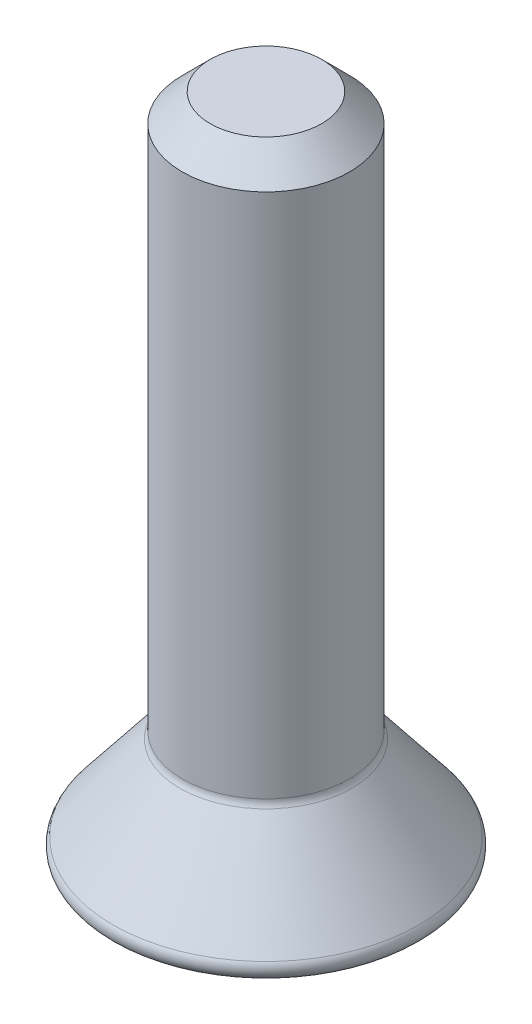
from build123d import *

# Parameters (mm, degrees)
SKETCH_2_R          = 1.5
EXTRUDE_1_DEPTH     = 10
CUT_EXTRUDE_1_DEPTH = 1
CHAMFER_1_SIZE      = 0.5
FILLET_1_R          = 0.2


with BuildPart() as part:
    # 草图1 → 旋转2 (revolve)
    with BuildSketch(Plane.XY, mode=Mode.PRIVATE) as revolve_2_sk:
        Polygon((0, 1.9), (1.5, 1.9), (3, 0), (0, 0), align=None)
    revolve(revolve_2_sk.sketch.rotate(Axis((0, 3.310292653, 0), (0, -1, 0)), 90), axis=Axis((0, 3.310292653, 0), (0, -1, 0)))

    # 草图2 → 凸台-拉伸1 (add)
    with BuildSketch(Plane(origin=(0, 1.9, 0), x_dir=(1, 0, 0), z_dir=(0, 1, 0))):
        with Locations(Location((0, 0, 0), (0, 0, 270))):
            Circle(SKETCH_2_R)
    extrude(amount=EXTRUDE_1_DEPTH)

    # 草图3 → 切除-拉伸1 (cut)
    with BuildSketch(Plane.XZ):
        Polygon((0, 1.154700538), (-1, 0.577350269), (-1, -0.577350269), (0, -1.154700538), (1, -0.577350269), (1, 0.577350269), align=None)
    extrude(amount=-CUT_EXTRUDE_1_DEPTH, mode=Mode.SUBTRACT)

    # 倒角1
    chamfer_1_edges = [part.edges().sort_by_distance(p)[0] for p in [
        (0, 11.9, -1.5),
    ]]
    chamfer(chamfer_1_edges, length=CHAMFER_1_SIZE)

    # 圆角1
    fillet_1_edges = [part.edges().sort_by_distance(p)[0] for p in [
        (0, 0, -3),
        (0, 1.9, -1.5),
    ]]
    fillet(fillet_1_edges, radius=FILLET_1_R)


solid = part.part
